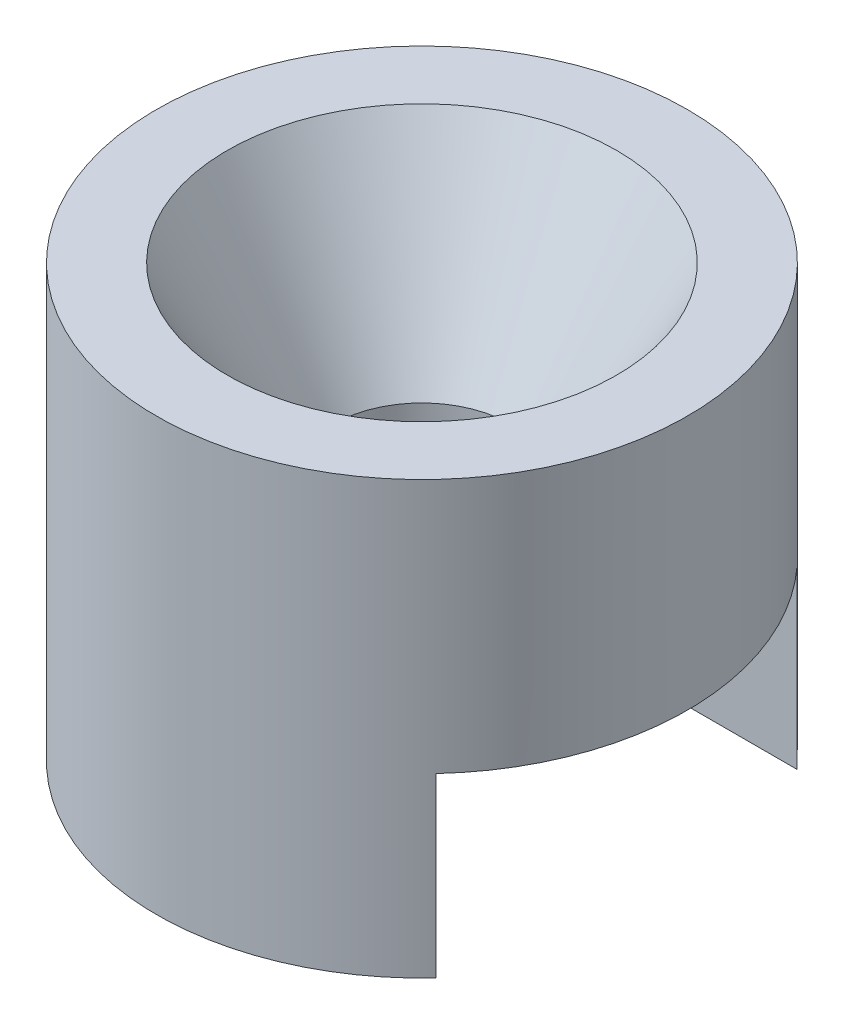
from build123d import *
from build123d.topology import SkipClean

# Parameters (mm, degrees)
SKETCH7_R           = 7.5
SKETCH7_R_2         = 2.5
BOSS_EXTRUDE3_DEPTH = 2
BOSS_EXTRUDE4_START = 5
BOSS_EXTRUDE4_DEPTH = 5


with BuildPart() as part:
    # Sketch7 → Boss-Extrude3 (new body)
    with BuildSketch(Plane(origin=(0, 0, 0), x_dir=(1, 0, 0), z_dir=(0, 1, 0))):
        with Locations(Location((0, 0, 0), (0, 0, 270))):
            Circle(SKETCH7_R)
        with Locations(Location((0, 0, 0), (0, 0, 270))):
            Circle(SKETCH7_R_2, mode=Mode.SUBTRACT)
    extrude(amount=BOSS_EXTRUDE3_DEPTH)

    # Sketch8 → Boss-Extrude4 (add)
    with SkipClean():  # the faces are left unmerged after this step: merging them gives an invalid solid
        with BuildSketch(Plane.XZ.offset(BOSS_EXTRUDE4_START)):
            with BuildLine():
                ThreePointArc((5.499090834, 5.1), (0, 7.5), (-5.499090834, 5.1))
                Line((-5.499090834, 5.1), (5.499090834, 5.1))
            make_face()
            with BuildLine():
                Line((5.499090834, -5.1), (-5.499090834, -5.1))
                ThreePointArc((-5.499090834, -5.1), (0, -7.5), (5.499090834, -5.1))
            make_face()
        extrude(amount=-BOSS_EXTRUDE4_DEPTH)

    # Sketch9 → Revolve1 (revolve)
    with SkipClean():  # the faces are left unmerged after this step: merging them gives an invalid solid
        with BuildSketch(Plane.XY, mode=Mode.PRIVATE) as revolve1_sk:
            Polygon((2.5, 2), (5.5, 7.196152423), (7.5, 7.196152423), (7.5, 2), align=None)
        revolve(revolve1_sk.sketch.rotate(Axis((0, 0, 0), (0, 1, 0)), 90), axis=Axis((0, 0, 0), (0, 1, 0)))


solid = part.part
